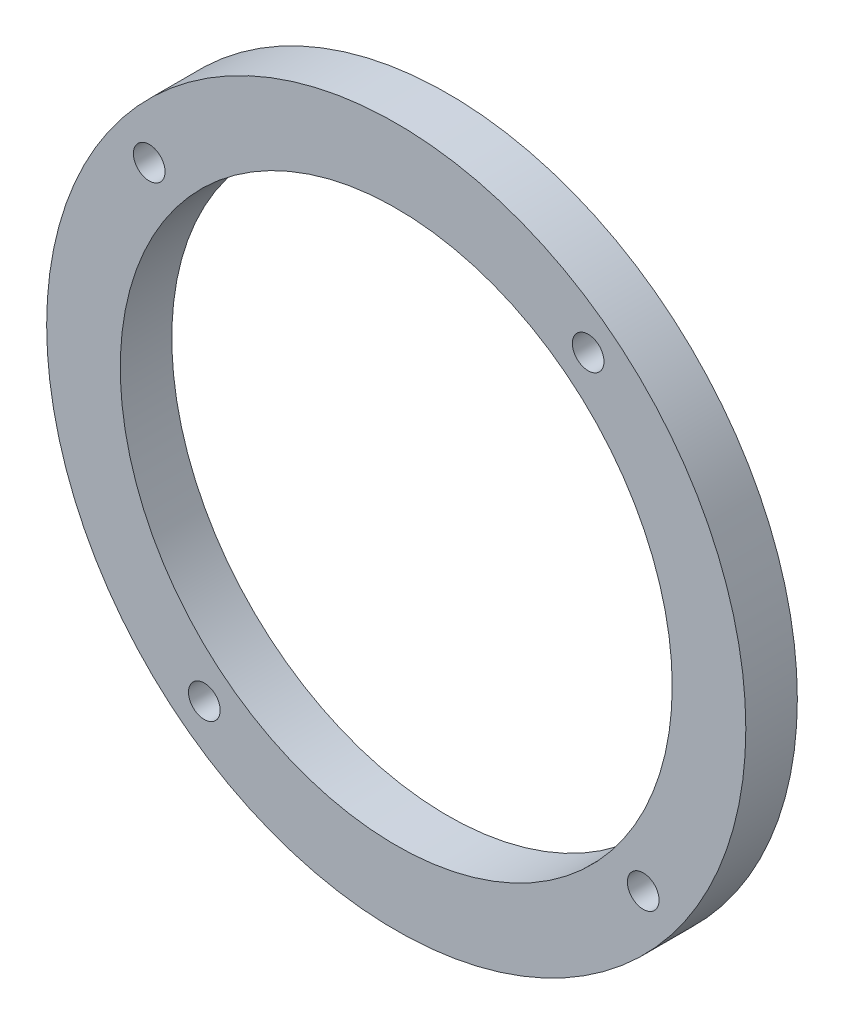
from build123d import *

# Parameters (mm, degrees)
SKETCH_1_R          = 47.5
SKETCH_1_R_2        = 37.5
EXTRUDE_1_DEPTH     = 7
CUT_EXTRUDE_1_REACH = 69.539
SKETCH_2_R          = 2.15


with BuildPart() as part:
    # 草图1 → 凸台-拉伸1 (new body)
    with BuildSketch(Plane.XY):
        Circle(SKETCH_1_R)
        Circle(SKETCH_1_R_2, mode=Mode.SUBTRACT)
    extrude(amount=EXTRUDE_1_DEPTH)

    # 草图2 → 切除-拉伸1 (cut, up to next)
    with BuildSketch(Plane.XY.offset(7), mode=Mode.PRIVATE) as cut_extrude_1_sk1:
        with Locations((-33.559809212, 26.076602647)):
            Circle(SKETCH_2_R)
    cut_extrude_1_tool1 = extrude(cut_extrude_1_sk1.sketch, amount=-CUT_EXTRUDE_1_REACH, mode=Mode.PRIVATE) & part.part
    # 草图2 → 切除-拉伸1 (cut, up to next)
    with BuildSketch(Plane.XY.offset(7), mode=Mode.PRIVATE) as cut_extrude_1_sk2:
        with Locations((26.076602647, 33.559809212)):
            Circle(SKETCH_2_R)
    cut_extrude_1_tool2 = extrude(cut_extrude_1_sk2.sketch, amount=-CUT_EXTRUDE_1_REACH, mode=Mode.PRIVATE) & part.part
    # 草图2 → 切除-拉伸1 (cut, up to next)
    with BuildSketch(Plane.XY.offset(7), mode=Mode.PRIVATE) as cut_extrude_1_sk3:
        with Locations((33.559809212, -26.076602647)):
            Circle(SKETCH_2_R)
    cut_extrude_1_tool3 = extrude(cut_extrude_1_sk3.sketch, amount=-CUT_EXTRUDE_1_REACH, mode=Mode.PRIVATE) & part.part
    # 草图2 → 切除-拉伸1 (cut, up to next)
    with BuildSketch(Plane.XY.offset(7), mode=Mode.PRIVATE) as cut_extrude_1_sk4:
        with Locations((-26.076602647, -33.559809212)):
            Circle(SKETCH_2_R)
    cut_extrude_1_tool4 = extrude(cut_extrude_1_sk4.sketch, amount=-CUT_EXTRUDE_1_REACH, mode=Mode.PRIVATE) & part.part
    add(cut_extrude_1_tool1.solids().sort_by_distance((-33.559809, 26.076603, 7))[0], mode=Mode.SUBTRACT)
    add(cut_extrude_1_tool2.solids().sort_by_distance((26.076603, 33.559809, 7))[0], mode=Mode.SUBTRACT)
    add(cut_extrude_1_tool3.solids().sort_by_distance((33.559809, -26.076603, 7))[0], mode=Mode.SUBTRACT)
    add(cut_extrude_1_tool4.solids().sort_by_distance((-26.076603, -33.559809, 7))[0], mode=Mode.SUBTRACT)


solid = part.part
